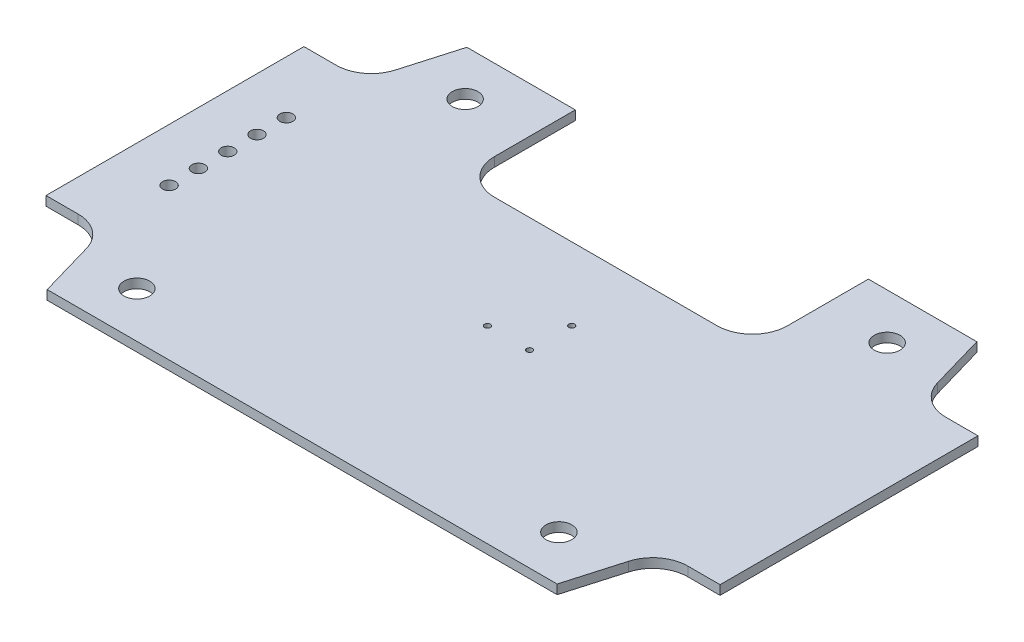
from build123d import *

# Parameters (mm, degrees)
SKETCH1_W                             = 57.5
SKETCH1_H                             = 35.8
BASE_EXTRUSION_DEPTH                  = 0.79375
SKETCH2_R                             = 0.25
PIR_MOUNTING_HOLES_DEPTH              = 36.158249943
SKETCH3_R                             = 0.555
CONNECTOR_MOUNTING_HOLE_DEPTH         = 36.158249943
CONNECTOR_MOUNTING_HOLE_PATTERN_COUNT = 5
CONNECTOR_MOUNTING_HOLE_PATTERN_PITCH = 2.5
SKETCH4_W                             = 25
SKETCH4_H                             = 9.9
LED_DRIVER_CLEARANCE_CUT_DEPTH        = 36.158249943
LED_DRIVER_CLEARANCE_CUT_FILLETS_R    = 3
CORNER_CUTOUT_DEPTH                   = 36.158249943
SKETCH7_R                             = 1.1
MOUNTING_SCREW_HOLES_DEPTH            = 36.158249943


with BuildPart() as part:
    # Sketch1 → Base Extrusion (new body)
    with BuildSketch(Plane(origin=(0, 0, 0), x_dir=(1, 0, 0), z_dir=(0, 1, 0))):
        with Locations((-1.5, 0)):
            Rectangle(SKETCH1_W, SKETCH1_H)
    extrude(amount=BASE_EXTRUSION_DEPTH)

    # Sketch2 → PIR Mounting Holes (cut, through all)
    with BuildSketch(Plane(origin=(0, 0.79375, 0), x_dir=(1, 0, 0), z_dir=(0, 1, 0))):
        with Locations(Location((1.796051224, -1.796051224, 0), (0, 0, 270))):
            Circle(SKETCH2_R)
        with Locations(Location((1.796051224, 1.796051224, 0), (0, 0, 270))):
            Circle(SKETCH2_R)
        with Locations(Location((-1.796051224, -1.796051224, 0), (0, 0, 270))):
            Circle(SKETCH2_R)
    extrude(amount=-PIR_MOUNTING_HOLES_DEPTH, mode=Mode.SUBTRACT)

    # Sketch3 → Connector Mounting Hole (cut, through all)
    with BuildSketch(Plane(origin=(0, 0.79375, 0), x_dir=(1, 0, 0), z_dir=(0, 1, 0))):
        with Locations(Location((-25.75, 5, 0), (0, 0, 270))):
            Circle(SKETCH3_R)
    connector_mounting_hole = extrude(amount=-CONNECTOR_MOUNTING_HOLE_DEPTH, mode=Mode.SUBTRACT)

    # Connector Mounting Hole Pattern: Connector Mounting Hole ×5
    with Locations(*[(0, 0, i * CONNECTOR_MOUNTING_HOLE_PATTERN_PITCH) for i in range(1, CONNECTOR_MOUNTING_HOLE_PATTERN_COUNT)]):
        add(connector_mounting_hole, mode=Mode.SUBTRACT)

    # Sketch4 → LED Driver Clearance Cut (cut, through all)
    with BuildSketch(Plane.XZ):
        with Locations((-1.5, -12.95)):
            Rectangle(SKETCH4_W, SKETCH4_H)
    extrude(amount=-LED_DRIVER_CLEARANCE_CUT_DEPTH, mode=Mode.SUBTRACT)

    # LED Driver Clearance Cut Fillets
    led_driver_clearance_cut_fillets_edges = [part.edges().sort_by_distance(p)[0] for p in [
        (-14, 0.396875, -8),
        (11, 0.396875, -8),
    ]]
    fillet(led_driver_clearance_cut_fillets_edges, radius=LED_DRIVER_CLEARANCE_CUT_FILLETS_R)

    # Sketch5 → Corner Cutout (cut, through all)
    with BuildSketch(Plane(origin=(0, 0.79375, 0), x_dir=(1, 0, 0), z_dir=(0, 1, 0))):
        with BuildLine():
            Line((-30.25, 11), (-27.5, 11))
            ThreePointArc((-27.5, 11), (-25.697080654, 11.602192287), (-24.617964056, 13.167012113))
            Line((-24.617964056, 13.167012113), (-23.25, 17.9))
            Line((-23.25, 17.9), (-30.25, 17.9))
            Line((-30.25, 17.9), (-30.25, 11))
        make_face()
        with BuildLine():
            Line((20.25, 17.9), (21.617964056, 13.167012113))
            ThreePointArc((21.617964056, 13.167012113), (22.697080654, 11.602192287), (24.5, 11))
            Line((24.5, 11), (27.25, 11))
            Line((27.25, 11), (27.25, 17.9))
            Line((27.25, 17.9), (20.25, 17.9))
        make_face()
    corner_cutout = extrude(amount=-CORNER_CUTOUT_DEPTH, mode=Mode.SUBTRACT)

    # Corner Cut Mirror: Corner Cutout across plane
    add(corner_cutout.mirror(Plane.XY), mode=Mode.SUBTRACT)

    # Sketch7 → Mounting Screw Holes (cut, through all)
    with BuildSketch(Plane(origin=(0, 0.79375, 0), x_dir=(1, 0, 0), z_dir=(0, 1, 0))):
        with Locations(Location((-19.5, 14, 0), (0, 0, 270))):
            Circle(SKETCH7_R)
        with Locations(Location((-19.5, -14, 0), (0, 0, 270))):
            Circle(SKETCH7_R)
        with Locations(Location((16.5, -14, 0), (0, 0, 270))):
            Circle(SKETCH7_R)
        with Locations(Location((16.5, 14, 0), (0, 0, 270))):
            Circle(SKETCH7_R)
    extrude(amount=-MOUNTING_SCREW_HOLES_DEPTH, mode=Mode.SUBTRACT)


solid = part.part
